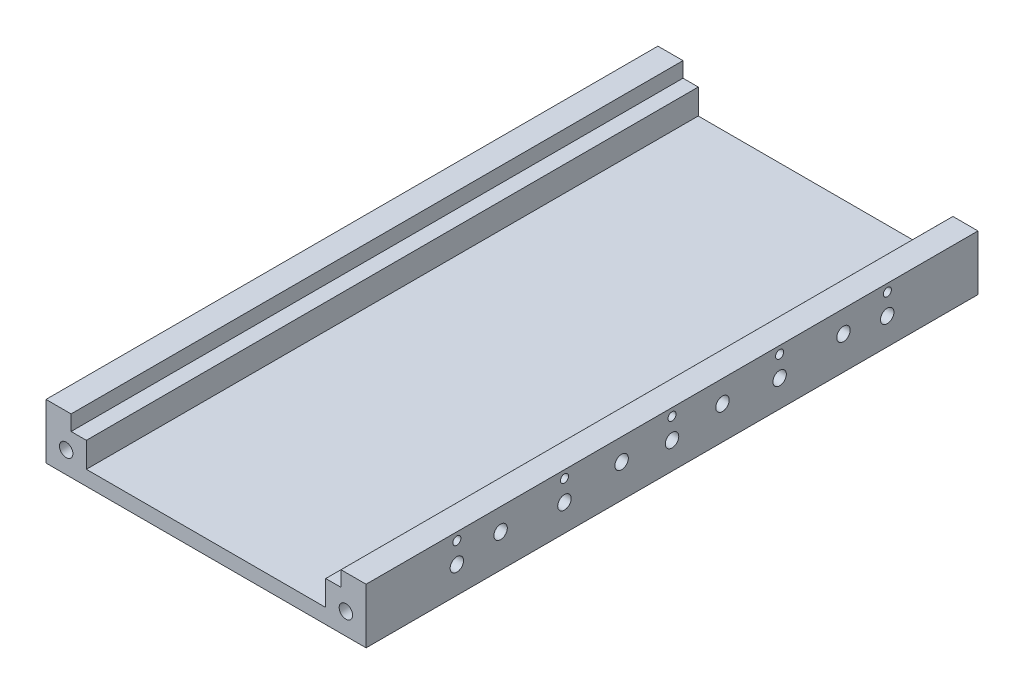
from build123d import *

# Parameters (mm, degrees)
BOSS_EXTRUDE1_DEPTH             = 227.5
TAP_DRILL_FOR_M5X0_8_TAP1_D     = 5
TAP_DRILL_FOR_M5X0_8_TAP1_DEPTH = 10
TAP_DRILL_FOR_M5X0_8_TAP2_D     = 5
TAP_DRILL_FOR_M5X0_8_TAP2_DEPTH = 10
TAP_DRILL_FOR_M5X0_8_TAP3_D     = 5
TAP_DRILL_FOR_M5X0_8_TAP3_DEPTH = 10
TAP_DRILL_FOR_M5X0_8_TAP4_D     = 5
TAP_DRILL_FOR_M5X0_8_TAP4_DEPTH = 10
TAP_DRILL_FOR_M5X0_8_TAP5_D     = 5
TAP_DRILL_FOR_M5X0_8_TAP5_DEPTH = 5.5
TAP_DRILL_FOR_M5X0_8_TAP6_D     = 5
TAP_DRILL_FOR_M5X0_8_TAP6_DEPTH = 5.5
SKETCH18_R                      = 1.5
CUT_EXTRUDE2_DEPTH              = 29


with BuildPart() as part:
    # Sketch1 → Boss-Extrude1 (new body)
    with BuildSketch(Plane.XY):
        Polygon((44.5, 5.5), (-44.5, 5.5), (-44.5, 14.835), (-50.17, 14.835), (-50.17, 20.5), (-59.5, 20.5), (-59.5, 0), (59.5, 0), (59.5, 20.5), (50.17, 20.5), (50.17, 14.835), (44.5, 14.835), align=None)
    extrude(amount=BOSS_EXTRUDE1_DEPTH)

    # Tap Drill for M5x0.8 Tap1
    with Locations(Plane.XY.offset(227.5)):
        with Locations((52, 8), (-52, 8)):
            Hole(TAP_DRILL_FOR_M5X0_8_TAP1_D / 2, depth=TAP_DRILL_FOR_M5X0_8_TAP1_DEPTH)

    # Tap Drill for M5x0.8 Tap2
    with Locations(Plane(origin=(0, 0, 0), x_dir=(-1, 0, 0), z_dir=(0, 0, -1))):
        with Locations((52, 8), (-52, 8)):
            Hole(TAP_DRILL_FOR_M5X0_8_TAP2_D / 2, depth=TAP_DRILL_FOR_M5X0_8_TAP2_DEPTH)

    # Tap Drill for M5x0.8 Tap3
    with Locations(Plane(origin=(59.5, 0, 0), x_dir=(0, 0, -1), z_dir=(1, 0, 0))):
        with Locations((-193.75, 10), (-153.75, 10), (-113.75, 10), (-73.75, 10), (-33.75, 10)):
            Hole(TAP_DRILL_FOR_M5X0_8_TAP3_D / 2, depth=TAP_DRILL_FOR_M5X0_8_TAP3_DEPTH)

    # Tap Drill for M5x0.8 Tap4
    with Locations(Plane.ZY.offset(59.5)):
        with Locations((193.75, 10), (153.75, 10), (113.75, 10), (73.75, 10), (33.75, 10)):
            Hole(TAP_DRILL_FOR_M5X0_8_TAP4_D / 2, depth=TAP_DRILL_FOR_M5X0_8_TAP4_DEPTH)

    # Tap Drill for M5x0.8 Tap5
    with Locations(Plane(origin=(59.5, 0, 0), x_dir=(0, 0, -1), z_dir=(1, 0, 0))):
        with Locations((-177.5, 12.346163158), (-132.5, 12.346163158), (-95, 12.346163158), (-50, 12.346163158)):
            Hole(TAP_DRILL_FOR_M5X0_8_TAP5_D / 2, depth=TAP_DRILL_FOR_M5X0_8_TAP5_DEPTH)

    # Tap Drill for M5x0.8 Tap6
    with Locations(Plane.ZY.offset(59.5)):
        with Locations((50, 12.346163158), (95, 12.346163158), (132.5, 12.346163158), (177.5, 12.346163158)):
            Hole(TAP_DRILL_FOR_M5X0_8_TAP6_D / 2, depth=TAP_DRILL_FOR_M5X0_8_TAP6_DEPTH)

    # Sketch18 → Cut-Extrude2 (cut)
    with BuildSketch(Plane(origin=(59.5, 0, 0), x_dir=(0, 0, -1), z_dir=(1, 0, 0))):
        with Locations(Location((-193.75, 17.6675, 0), (0, 0, 90))):
            Circle(SKETCH18_R)
        with Locations(Location((-153.75, 17.6675, 0), (0, 0, 90))):
            Circle(SKETCH18_R)
        with Locations(Location((-113.75, 17.6675, 0), (0, 0, 90))):
            Circle(SKETCH18_R)
        with Locations(Location((-73.75, 17.6675, 0), (0, 0, 90))):
            Circle(SKETCH18_R)
        with Locations(Location((-33.704207464, 17.6675, 0), (0, 0, 90))):
            Circle(SKETCH18_R)
    extrude(amount=-CUT_EXTRUDE2_DEPTH, mode=Mode.SUBTRACT)


solid = part.part
